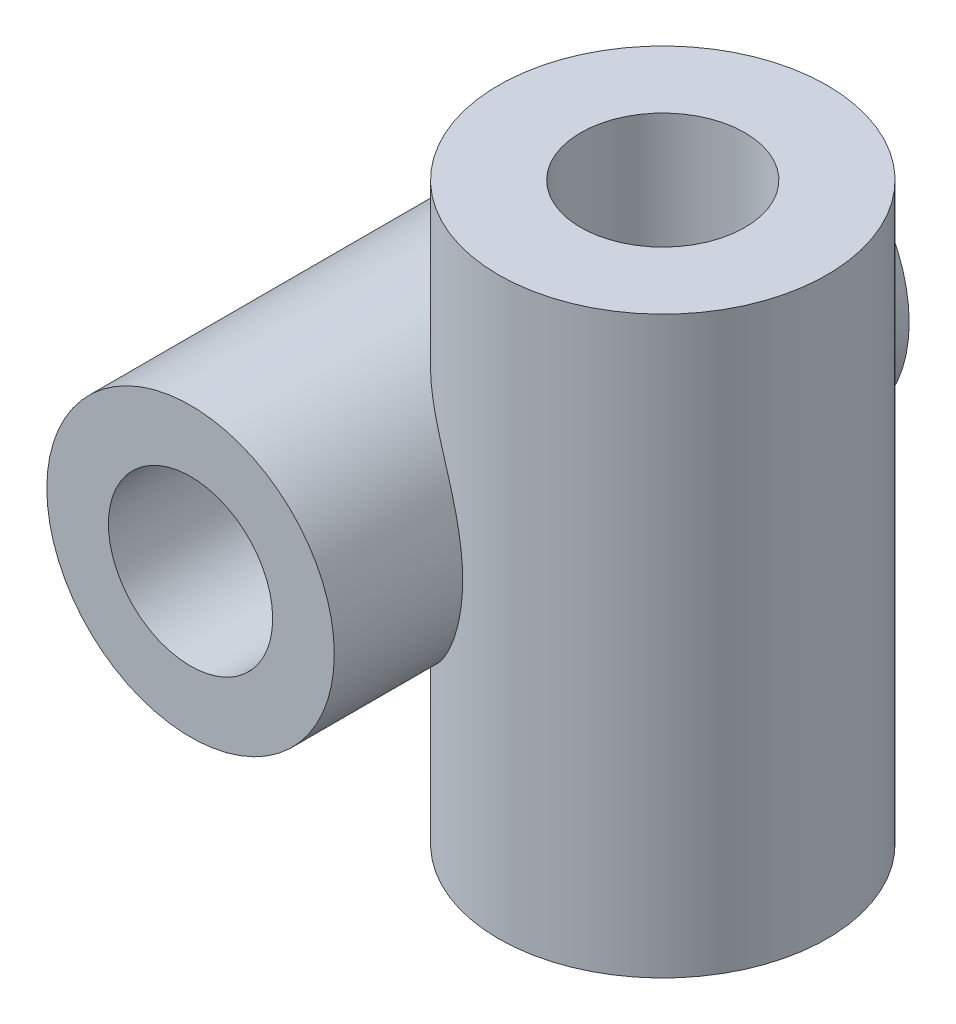
from build123d import *

# Parameters (mm, degrees)
SKETCH1_R           = 14
SKETCH1_R_2         = 8
BOSS_EXTRUDE1_DEPTH = 28
SKETCH2_W           = 8
SKETCH2_H           = 56
CUT_EXTRUDE1_START  = -56
SKETCH3_R           = 8
CUT_EXTRUDE1_DEPTH  = 56
CUT_EXTRUDE2_START  = -56
SKETCH4_R           = 8
CUT_EXTRUDE2_DEPTH  = 56


with BuildPart() as part:
    # Sketch1 → Boss-Extrude1 (new, symmetric)
    with BuildSketch(Plane.XY):
        Circle(SKETCH1_R)
        Circle(SKETCH1_R_2, mode=Mode.SUBTRACT)
    extrude(amount=BOSS_EXTRUDE1_DEPTH, both=True)

    # Sketch2 → Revolve1 (revolve)
    with BuildSketch(Plane.XY, mode=Mode.PRIVATE) as revolve1_sk:
        with Locations((30, 0)):
            Rectangle(SKETCH2_W, SKETCH2_H)
    revolve(revolve1_sk.sketch.rotate(Axis((18, -19.968284035, 0), (0, 1, 0)), 90), axis=Axis((18, -19.968284035, 0), (0, 1, 0)))

    # Sketch3 → Cut-Extrude1 (cut)
    with BuildSketch(Plane.XY.offset(28).offset(CUT_EXTRUDE1_START)):
        Circle(SKETCH3_R)
    extrude(amount=CUT_EXTRUDE1_DEPTH, mode=Mode.SUBTRACT)

    # Sketch4 → Cut-Extrude2 (cut)
    with BuildSketch(Plane(origin=(0, 28, 0), x_dir=(1, 0, 0), z_dir=(0, 1, 0)).offset(CUT_EXTRUDE2_START)):
        with Locations(Location((18, 0, 0), (0, 0, 90))):
            Circle(SKETCH4_R)
    extrude(amount=CUT_EXTRUDE2_DEPTH, mode=Mode.SUBTRACT)


solid = part.part
